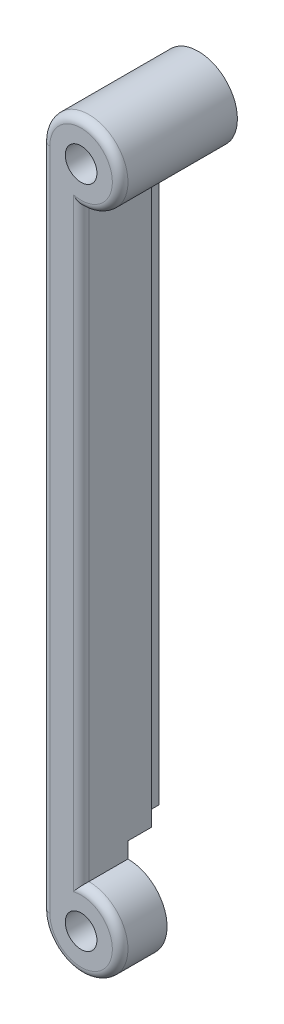
from build123d import *

# Parameters (mm, degrees)
SKETCH1_R             = 2.025
BOSS_EXTRUDE1_DEPTH   = 9
BOSS_EXTRUDE2_START   = -15
SKETCH2_R             = 5
SKETCH2_R_2           = 2.025
BOSS_EXTRUDE2_DEPTH   = 15
BOSS_EXTRUDE3_START   = -12
SKETCH3_R             = 2.025
BOSS_EXTRUDE3_DEPTH   = 12
CROQUIS1_W            = 6
CROQUIS1_H            = 12.01125174
CORTAR_EXTRUIR3_DEPTH = 10
REDONDEO1_R           = 1
REDONDEO2_R           = 1


with BuildPart() as part:
    # Sketch1 → Boss-Extrude1 (new body)
    with BuildSketch(Plane.XY):
        with BuildLine():
            Line((-5, 0), (-5, 85))
            ThreePointArc((-5, 85), (3.535533906, 88.535533906), (0, 80))
            Line((0, 80), (0, 5))
            ThreePointArc((0, 5), (5, 0), (0, -5))
            ThreePointArc((0, -5), (-3.535533906, -3.535533906), (-5, 0))
        make_face()
        with Locations((0, 85)):
            Circle(SKETCH1_R, mode=Mode.SUBTRACT)
        Circle(SKETCH1_R, mode=Mode.SUBTRACT)
    extrude(amount=BOSS_EXTRUDE1_DEPTH)

    # Sketch2 → Boss-Extrude2 (add)
    with BuildSketch(Plane.XY.offset(9).offset(BOSS_EXTRUDE2_START)):
        with Locations(Location((0, 85, 0), (0, 0, 180))):
            Circle(SKETCH2_R)
        with Locations((0, 85)):
            Circle(SKETCH2_R_2, mode=Mode.SUBTRACT)
    extrude(amount=BOSS_EXTRUDE2_DEPTH)

    # Sketch3 → Boss-Extrude3 (add)
    with BuildSketch(Plane.XY.offset(9).offset(BOSS_EXTRUDE3_START)):
        with BuildLine():
            Line((-5, 0), (-5, 85))
            ThreePointArc((-5, 85), (-4.183300133, 82.261387212), (-2, 80.417424305))
            Line((-2, 80.417424305), (-2, 5))
            Line((-2, 5), (0, 5))
            ThreePointArc((0, 5), (5, 0), (0, -5))
            ThreePointArc((0, -5), (-3.535533906, -3.535533906), (-5, 0))
        make_face()
        Circle(SKETCH3_R, mode=Mode.SUBTRACT)
    extrude(amount=BOSS_EXTRUDE3_DEPTH)

    # Croquis1 → Cortar-Extruir3 (cut)
    with BuildSketch(Plane.ZY.offset(5)):
        with Locations((0, 1.00562587)):
            Rectangle(CROQUIS1_W, CROQUIS1_H)
    extrude(amount=-CORTAR_EXTRUIR3_DEPTH, mode=Mode.SUBTRACT)

    # Redondeo1
    redondeo1_edges = [part.edges().sort_by_distance(p)[0] for p in [
        (-1.021548218, 80.105468435, 0),
        (-2, 43.714338023, 0),
    ]]
    fillet(redondeo1_edges, radius=REDONDEO1_R)

    # Redondeo2
    redondeo2_edges = [part.edges().sort_by_distance(p)[0] for p in [
        (0, 42.5, 9),
        (3.535533906, 88.535533906, 9),
        (-5, 42.5, 9),
        (3.535533906, -3.535533906, 9),
    ]]
    fillet(redondeo2_edges, radius=REDONDEO2_R)


solid = part.part
